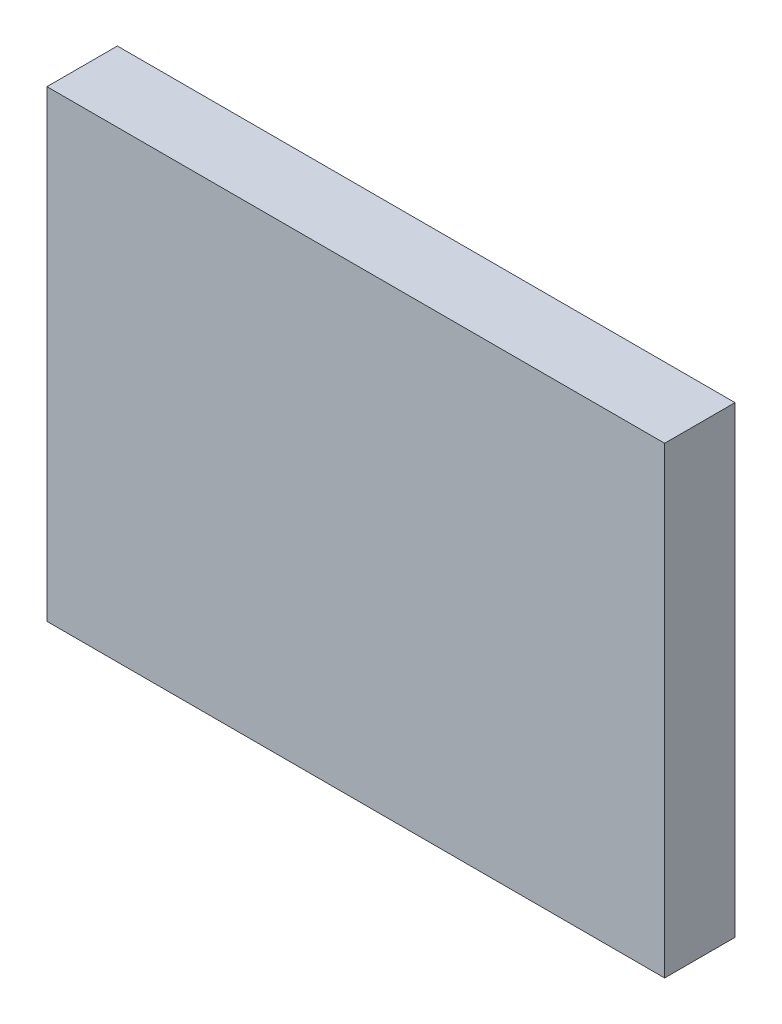
from build123d import *

# Parameters (mm, degrees)
SKETCH1_W           = 4000
SKETCH1_H           = 455.932560116
BOSS_EXTRUDE1_DEPTH = 2999


with BuildPart() as part:
    # Sketch1 → Boss-Extrude1 (new body)
    with BuildSketch(Plane(origin=(0, 0, 0), x_dir=(1, 0, 0), z_dir=(0, 1, 0))):
        with Locations((2000, 227.966280058)):
            Rectangle(SKETCH1_W, SKETCH1_H)
    extrude(amount=BOSS_EXTRUDE1_DEPTH)


solid = part.part
